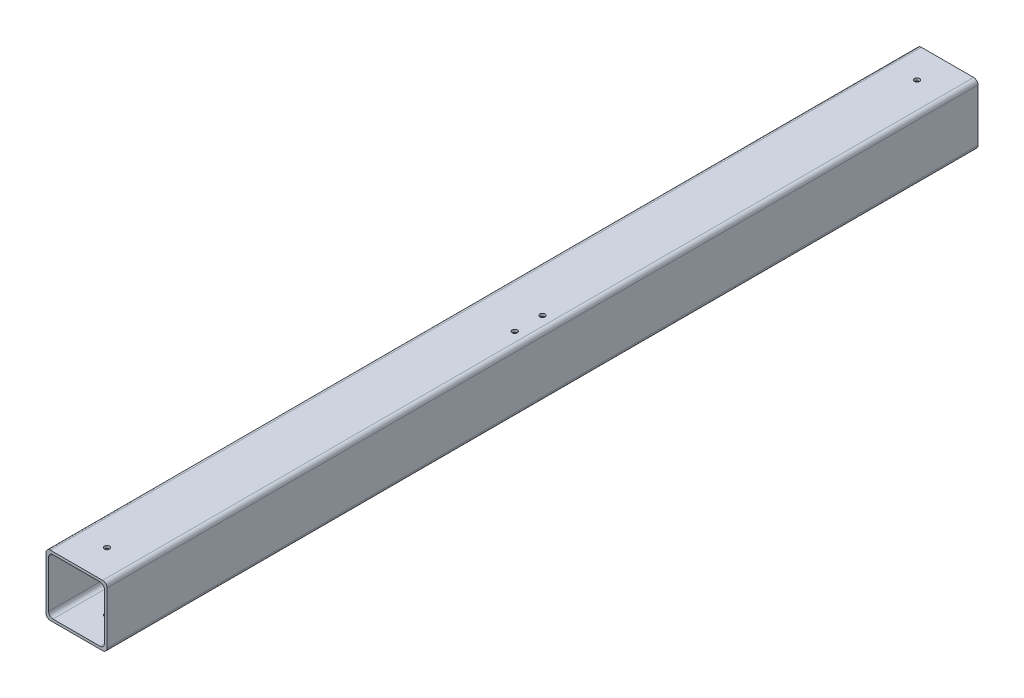
from build123d import *

# Parameters (mm, degrees)
SKETCH1_W           = 70
SKETCH1_H           = 70
SKETCH1_W_2         = 64
SKETCH1_H_2         = 64
BOSS_EXTRUDE1_DEPTH = 1000
FILLET1_R           = 5
SKETCH2_R           = 3
CUT_EXTRUDE1_DEPTH  = 70
SKETCH4_R           = 3
CUT_EXTRUDE2_DEPTH  = 70


with BuildPart() as part:
    # Sketch1 → Boss-Extrude1 (new body)
    with BuildSketch(Plane.XY):
        with Locations((35, 35)):
            Rectangle(SKETCH1_W, SKETCH1_H)
        with Locations((35, 35)):
            Rectangle(SKETCH1_W_2, SKETCH1_H_2, mode=Mode.SUBTRACT)
    extrude(amount=BOSS_EXTRUDE1_DEPTH)

    # Fillet1
    fillet1_edges = [part.edges().sort_by_distance(p)[0] for p in [
        (3, 67, 500),
        (3, 3, 500),
        (67, 3, 500),
        (67, 67, 500),
        (0, 70, 500),
        (70, 70, 500),
        (70, 0, 500),
        (0, 0, 500),
    ]]
    fillet(fillet1_edges, radius=FILLET1_R)

    # Sketch2 → Cut-Extrude1 (cut)
    with BuildSketch(Plane(origin=(0, 70, 0), x_dir=(1, 0, 0), z_dir=(0, 1, 0))):
        with Locations(Location((35, -965, 0), (0, 0, 270))):
            Circle(SKETCH2_R)
        with Locations(Location((35, -35, 0), (0, 0, 270))):
            Circle(SKETCH2_R)
    extrude(amount=-CUT_EXTRUDE1_DEPTH, mode=Mode.SUBTRACT)

    # Sketch4 → Cut-Extrude2 (cut)
    with BuildSketch(Plane.XZ):
        with Locations(Location((54.09, 515.91, 0), (0, 0, 270))):
            Circle(SKETCH4_R)
        with Locations(Location((54.09, 484.09, 0), (0, 0, 270))):
            Circle(SKETCH4_R)
    extrude(amount=-CUT_EXTRUDE2_DEPTH, mode=Mode.SUBTRACT)


solid = part.part
